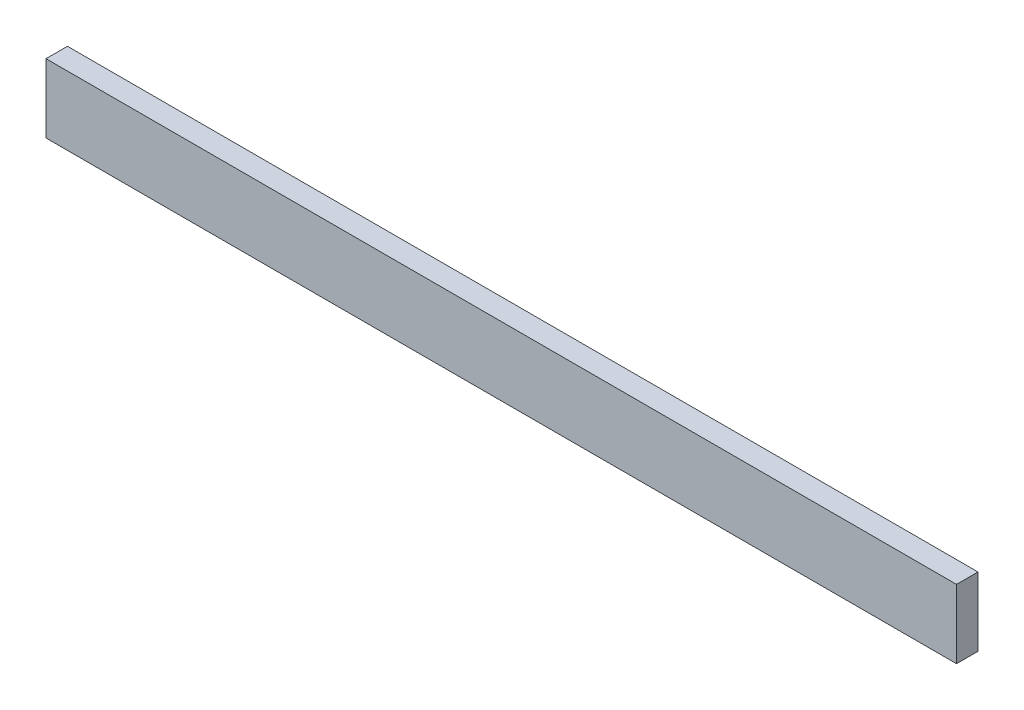
from build123d import *

# Parameters (mm, degrees)
CROQUIS_FALDON_W   = 1060
CROQUIS_FALDON_H   = 25
FALDON_LARGO_DEPTH = 80


with BuildPart() as part:
    # Croquis_faldon → Faldon_largo (new body)
    with BuildSketch(Plane(origin=(0, 0, 0), x_dir=(1, 0, 0), z_dir=(0, 1, 0))):
        Rectangle(CROQUIS_FALDON_W, CROQUIS_FALDON_H)
    extrude(amount=FALDON_LARGO_DEPTH)


solid = part.part
